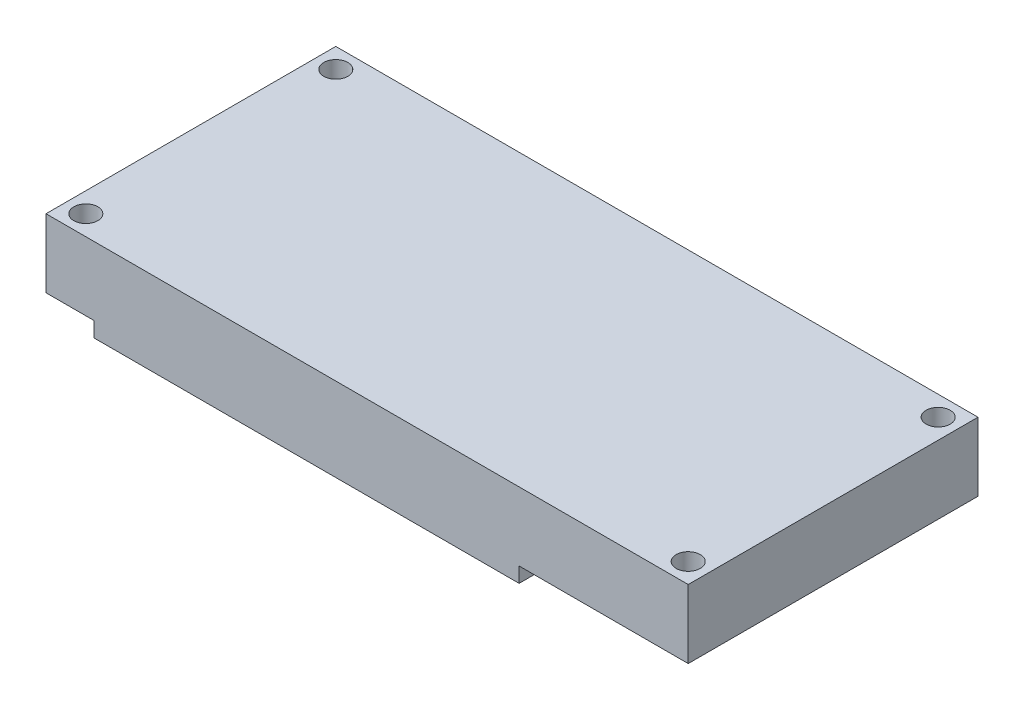
from build123d import *

# Parameters (mm, degrees)
SKETCH1_W           = 79.98
SKETCH1_H           = 36.09
SKETCH1_R           = 1.5
BOSS_EXTRUDE1_DEPTH = 8.53
SKETCH2_W           = 52.92
SKETCH2_H           = 36.09
BOSS_EXTRUDE2_DEPTH = 1.88


with BuildPart() as part:
    # Sketch1 → Boss-Extrude1 (new body)
    with BuildSketch(Plane(origin=(0, 0, 0), x_dir=(1, 0, 0), z_dir=(0, 1, 0))):
        Rectangle(SKETCH1_W, SKETCH1_H)
        with Locations(Location((-37.51, 15.565, 0), (0, 0, 270))):
            Circle(SKETCH1_R, mode=Mode.SUBTRACT)
        with Locations(Location((37.51, 15.565, 0), (0, 0, 90))):
            Circle(SKETCH1_R, mode=Mode.SUBTRACT)
        with Locations(Location((37.51, -15.565, 0), (0, 0, 270))):
            Circle(SKETCH1_R, mode=Mode.SUBTRACT)
        with Locations(Location((-37.51, -15.565, 0), (0, 0, 90))):
            Circle(SKETCH1_R, mode=Mode.SUBTRACT)
    extrude(amount=BOSS_EXTRUDE1_DEPTH)

    # Sketch2 → Boss-Extrude2 (add)
    with BuildSketch(Plane.XZ):
        with Locations((-7.53, 0)):
            Rectangle(SKETCH2_W, SKETCH2_H)
    extrude(amount=BOSS_EXTRUDE2_DEPTH)


solid = part.part
